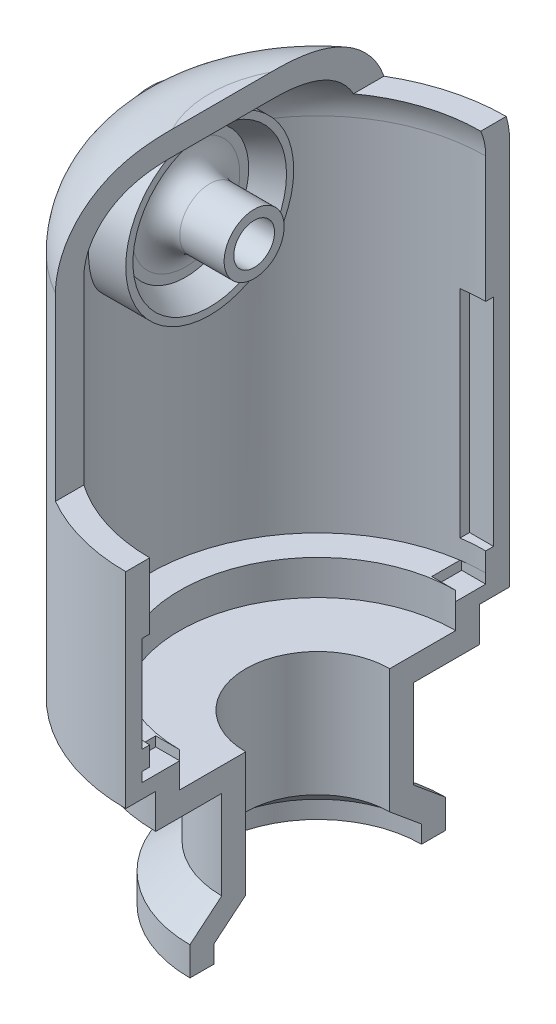
from build123d import *

# Parameters (mm, degrees)
SKETCH_1_R               = 16
EXTRUDE_1_DEPTH          = 54
FILLET_1_R               = 7
SHELL_1_T                = -2
CUT_EXTRUDE_1_DEPTH      = 59.549124673
CUT_EXTRUDE_1_DEPTH_BACK = 59.549124673
SKETCH_3_W               = 17.994708596
SKETCH_3_H               = 55.587571792
SKETCH_4_W               = 8
SKETCH_4_H               = 16.979772428
CUT_EXTRUDE_3_DEPTH      = 22
SKETCH_5_W               = 8
SKETCH_5_H               = 16.394935261
CUT_EXTRUDE_4_DEPTH      = 5
EXTRUDE_2_REACH          = 59.035
EXTRUDE_2_END_RADIUS     = 14
SKETCH_6_R               = 7
SKETCH_8_R               = 6.4
CUT_EXTRUDE_6_DEPTH      = 2
CUT_EXTRUDE_6_DRAFT      = -30
SKETCH_10_W              = 0.8
SKETCH_10_H              = 8
SKETCH_10_W_2            = 3.15
SKETCH_10_H_2            = 0.8
SKETCH_10_W_3            = 2.5
SKETCH_10_H_3            = 18
CUT_EXTRUDE_7_DEPTH      = 2
EXTRUDE_3_DEPTH          = 3.7
EXTRUDE_3_DEPTH_BACK     = 2
SKETCH_7_R               = 2.5
HOLE_WIZARD_M3_1_D       = 3.4
FILLET_3_R               = 2


with BuildPart() as part:
    # 스케치1 → 보스-돌출1 (new body)
    with BuildSketch(Plane(origin=(0, 0, 0), x_dir=(1, 0, 0), z_dir=(0, 1, 0))):
        with Locations(Location((0, 0, 0), (0, 0, 270))):
            Circle(SKETCH_1_R)
    extrude(amount=EXTRUDE_1_DEPTH)

    # 스케치2 → 컷-회전1 (revolve, cut)
    with BuildSketch(Plane.XY, mode=Mode.PRIVATE) as cut_revolve_1_sk:
        Polygon((19.244798042, 14.9), (13.5, 14.9), (13.5, 12), (8, 12), (8, 4.6), (10.65, 2.4), (10.65, 0), (19.244798042, 0), align=None)
    revolve(cut_revolve_1_sk.sketch.rotate(Axis((0, 0, 0), (0, 1, 0)), 90), axis=Axis((0, 0, 0), (0, 1, 0)), mode=Mode.SUBTRACT)

    # 필렛1
    fillet_1_edges = [part.edges().sort_by_distance(p)[0] for p in [
        (0, 54, -16),
    ]]
    fillet(fillet_1_edges, radius=FILLET_1_R)

    # 쉘1
    shell_1_openings = [part.faces().sort_by_distance(p)[0] for p in [
        (0, 0, 0),
    ]]
    offset(amount=SHELL_1_T, openings=shell_1_openings, kind=Kind.INTERSECTION)

    # 스케치3 → 컷-돌출1 (cut, two sides: drawn at the far end of the back side and taken through both)
    with BuildSketch(Plane.XY.offset(-CUT_EXTRUDE_1_DEPTH_BACK)):
        with Locations((8.997354298, 27.793785896)):
            Rectangle(SKETCH_3_W, SKETCH_3_H)
    extrude(amount=CUT_EXTRUDE_1_DEPTH + CUT_EXTRUDE_1_DEPTH_BACK, mode=Mode.SUBTRACT)

    # 스케치4 → 컷-돌출3 (cut)
    with BuildSketch(Plane(origin=(0, 54, 0), x_dir=(1, 0, 0), z_dir=(0, 1, 0))):
        with Locations((-4, -8.489886214)):
            Rectangle(SKETCH_4_W, SKETCH_4_H)
    extrude(amount=-CUT_EXTRUDE_3_DEPTH, mode=Mode.SUBTRACT)

    # 스케치5 → 컷-돌출4 (cut)
    with BuildSketch(Plane(origin=(0, 54, 0), x_dir=(1, 0, 0), z_dir=(0, 1, 0))):
        with Locations((-4, 8.197467631)):
            Rectangle(SKETCH_5_W, SKETCH_5_H)
    extrude(amount=-CUT_EXTRUDE_4_DEPTH, mode=Mode.SUBTRACT)

    # 보스-돌출2: up to this cylinder (the profile starts inside it)
    extrude_2_end = Plane(origin=(0, 45, 0), z_dir=(0, -1, 0)) * Cylinder(EXTRUDE_2_END_RADIUS, 147.07, mode=Mode.PRIVATE)
    # 스케치6 → 보스-돌출2 (add, up to the surface)
    with BuildSketch(Plane(origin=(-9, 0, 0), x_dir=(0, 0, -1), z_dir=(1, 0, 0)), mode=Mode.PRIVATE) as extrude_2_sk1:
        with Locations((0, 45)):
            Circle(SKETCH_6_R)
    extrude_2_tool1 = extrude(extrude_2_sk1.sketch, amount=-EXTRUDE_2_REACH, mode=Mode.PRIVATE) & extrude_2_end
    add(extrude_2_tool1.solids().sort_by_distance((-9, 45, 0))[0])


with BuildPart() as cut_extrude_6_tool:
    # 스케치8 → 컷-돌출6 (with draft: the straight prism first)
    with BuildSketch(Plane(origin=(-9, 0, 0), x_dir=(0, 0, -1), z_dir=(1, 0, 0))):
        with Locations((0, 45)):
            Circle(SKETCH_8_R)
    extrude(amount=-CUT_EXTRUDE_6_DEPTH)
    # 컷-돌출6: the draft: its side faces are tilted about the plane it starts from
    cut_extrude_6_sides = [cut_extrude_6_tool.faces().sort_by_distance(p)[0] for p in [
        (-10, 45, 6.4),
    ]]
    draft(cut_extrude_6_sides, Plane(origin=(-9, 0, 0), x_dir=(0, 0, -1), z_dir=(1, 0, 0)), CUT_EXTRUDE_6_DRAFT)


with BuildPart() as part_1:
    add(part.part)

    # 컷-돌출6: cut by cut_extrude_6_tool
    add(cut_extrude_6_tool.part, mode=Mode.SUBTRACT)

    # 스케치10 → 컷-돌출7 (cut)
    with BuildSketch(Plane(origin=(0, 0, 0), x_dir=(0, 0, -1), z_dir=(1, 0, 0))):
        with Locations((-14.25, 22.5)):
            Rectangle(SKETCH_10_W, SKETCH_10_H)
        with Locations((-13.075, 16.5)):
            Rectangle(SKETCH_10_W_2, SKETCH_10_H_2)
        with Locations((12.75, 16.5)):
            Rectangle(SKETCH_10_W_3, SKETCH_10_H_2)
        with Locations((14.25, 27.5)):
            Rectangle(SKETCH_10_W, SKETCH_10_H_3)
    extrude(amount=-CUT_EXTRUDE_7_DEPTH, mode=Mode.SUBTRACT)

    # 스케치7 → 보스-돌출3 (add, two sides: drawn at the far end of the back side and taken through both)
    with BuildSketch(Plane(origin=(-9, 0, 0), x_dir=(0, 0, -1), z_dir=(1, 0, 0)).offset(-EXTRUDE_3_DEPTH_BACK)):
        with Locations((0, 45)):
            Circle(SKETCH_7_R)
    extrude(amount=EXTRUDE_3_DEPTH + EXTRUDE_3_DEPTH_BACK)

    # M3 여유 구멍1 (through all)
    with Locations(Plane(origin=(-5.3, 45, 0), x_dir=(0, 0, 1), z_dir=(1, 0, 0))):
        with Locations((0, 0)):
            Hole(HOLE_WIZARD_M3_1_D / 2)

    # 필렛3
    fillet_3_edges = [part_1.edges().sort_by_distance(p)[0] for p in [
        (-11, 45, 2.5),
    ]]
    fillet(fillet_3_edges, radius=FILLET_3_R)


solid = part_1.part
